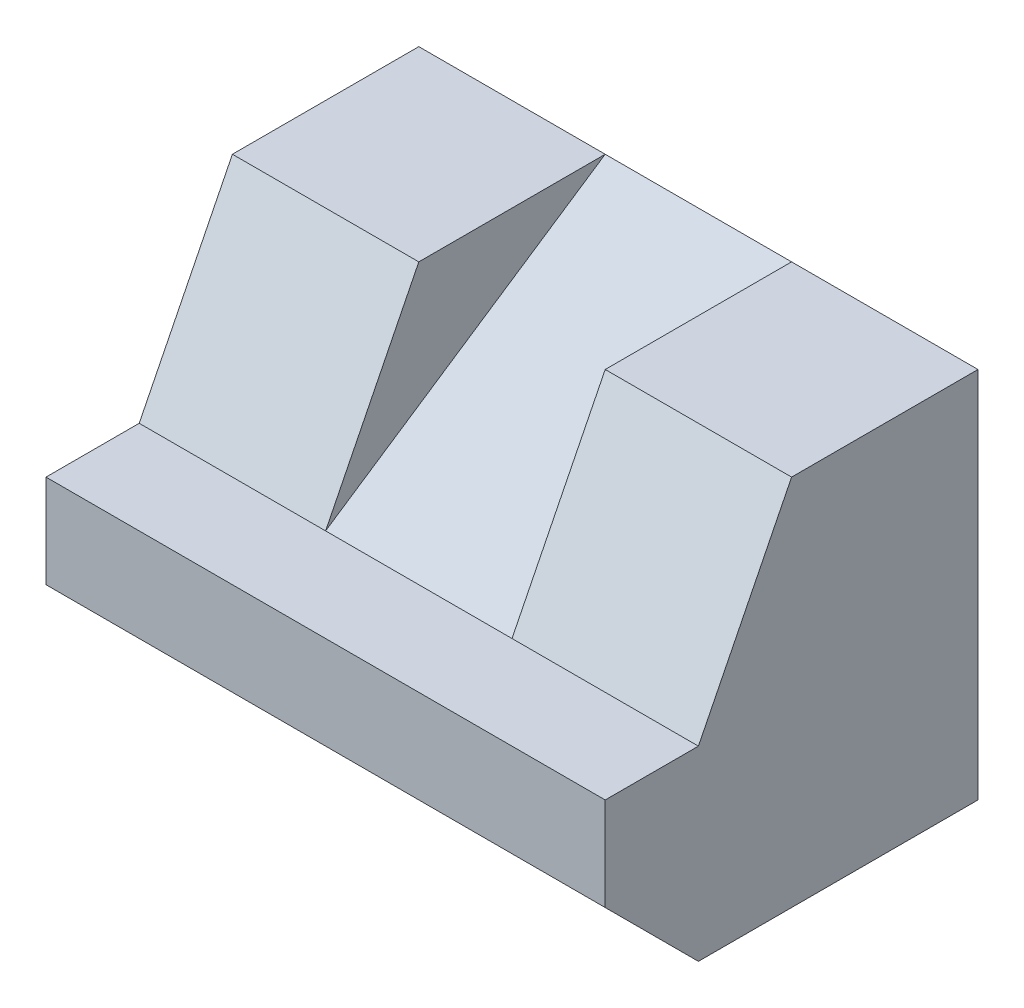
from build123d import *

# Parameters (mm, degrees)
SALIENTE_EXTRUIR2_DEPTH = 76.2
CORTAR_EXTRUIR3_START   = -25.4
CORTAR_EXTRUIR3_DEPTH   = 25.4


with BuildPart() as part:
    # Croquis2 → Saliente-Extruir2 (new body)
    with BuildSketch(Plane(origin=(0, 0, 0), x_dir=(0, 0, -1), z_dir=(1, 0, 0))):
        Polygon((0, 0), (38.1, 0), (38.1, 50.8), (12.7, 50.8), (0, 25.4), (-12.7, 25.4), (-12.7, 12.7), align=None)
    extrude(amount=SALIENTE_EXTRUIR2_DEPTH)

    # Croquis4 → Cortar-Extruir3 (cut)
    with BuildSketch(Plane(origin=(76.2, 0, 0), x_dir=(0, 0, -1), z_dir=(1, 0, 0)).offset(CORTAR_EXTRUIR3_START)):
        Polygon((0, 25.4), (38.1, 50.8), (12.7, 50.8), align=None)
    extrude(amount=-CORTAR_EXTRUIR3_DEPTH, mode=Mode.SUBTRACT)


solid = part.part
